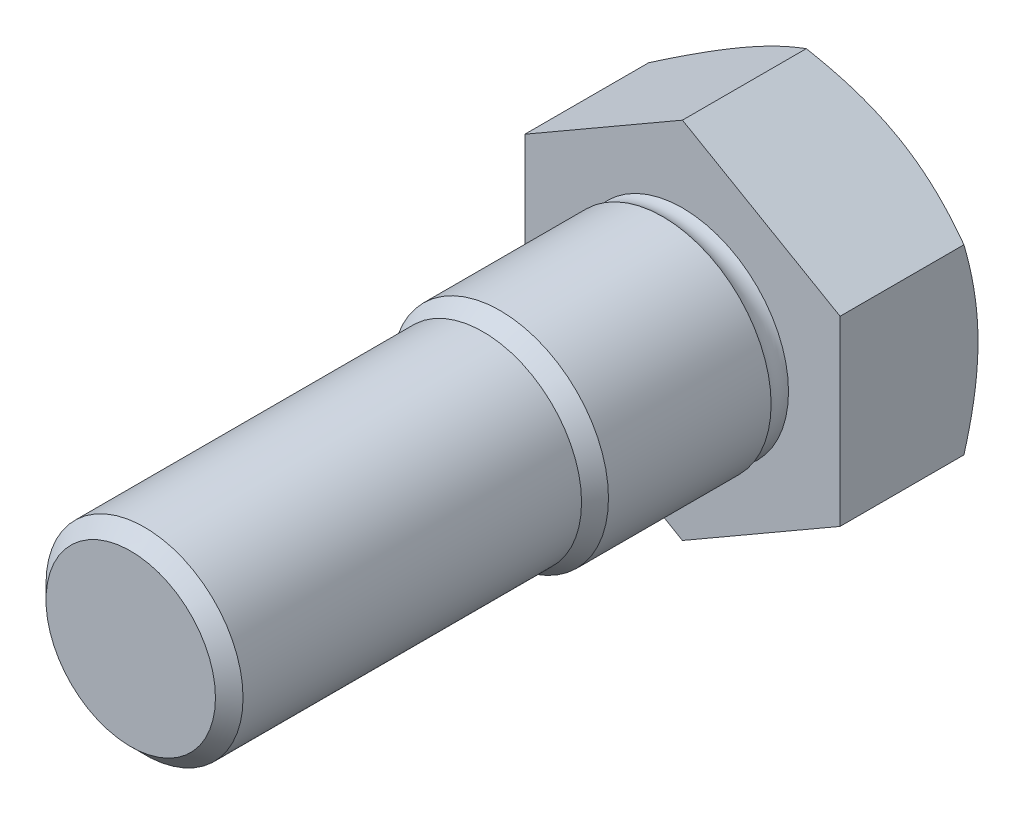
from build123d import *

# Parameters (mm, degrees)
VYSUNOUT1_DEPTH = 7
SKICA5_R        = 5
VYSUNOUT4_DEPTH = 28
ZKOSIT1_SIZE    = 0.7
SKICA3_R        = 5.3
VYSUNOUT2_DEPTH = 1
SKICA4_R        = 5.5
VYSUNOUT3_DEPTH = 9.12


with BuildPart() as part:
    # Skica1 → Vysunout1 (new body)
    with BuildSketch(Plane.XY):
        Polygon((8, -4.618802154), (8, 4.618802154), (0, 9.237604307), (-8, 4.618802154), (-8, -4.618802154), (0, -9.237604307), align=None)
    extrude(amount=VYSUNOUT1_DEPTH)

    # Skica2 → Odebrat otočením1 (revolve, cut)
    with BuildSketch(Plane(origin=(0, 0, 0), x_dir=(1, 0, 0), z_dir=(0, 1, 0))):
        Polygon((8, 0), (20.124355653, 0), (20.124355653, -7), align=None)
    revolve(axis=Axis((0, 0, 0), (0, 0, 1)), mode=Mode.SUBTRACT)

    # Skica5 → Vysunout4 (add)
    with BuildSketch(Plane.XY.offset(7)):
        Circle(SKICA5_R)
    extrude(amount=VYSUNOUT4_DEPTH)

    # Zkosit1
    zkosit1_edges = [part.edges().sort_by_distance(p)[0] for p in [
        (-5, 0, 35),
    ]]
    chamfer(zkosit1_edges, length=ZKOSIT1_SIZE)

    # Skica3 → Vysunout2 (add)
    with BuildSketch(Plane.XY.offset(7)):
        Circle(SKICA3_R)
    extrude(amount=VYSUNOUT2_DEPTH)

    # Skica4 → Vysunout3 (add)
    with BuildSketch(Plane.XY.offset(8)):
        Circle(SKICA4_R)
    extrude(amount=VYSUNOUT3_DEPTH)

    # Skica6 → Odebrat otočením2 (revolve, cut)
    with BuildSketch(Plane(origin=(0, 0, 0), x_dir=(1, 0, 0), z_dir=(0, 1, 0)), mode=Mode.PRIVATE) as odebrat_oto_en_m2_sk:
        Polygon((-5.5, -17.12), (-5.5, -16.253974596), (-5, -17.12), align=None)
    revolve(odebrat_oto_en_m2_sk.sketch.rotate(Axis((0, 0, 17.12), (0, 0, -1)), 180), axis=Axis((0, 0, 17.12), (0, 0, -1)), mode=Mode.SUBTRACT)

    # Skica7 → Otočit kolem osy1 (revolve)
    with BuildSketch(Plane(origin=(0, 0, 0), x_dir=(1, 0, 0), z_dir=(0, 1, 0))):
        with BuildLine():
            ThreePointArc((5.3, -7.4), (5.321093687, -7.195690356), (5.383484861, -7))
            Line((5.383484861, -7), (5.3, -7))
            Line((5.3, -7), (5.3, -7.4))
        make_face()
        with BuildLine():
            ThreePointArc((5.5, -8), (5.351316702, -7.716227766), (5.3, -7.4))
            Line((5.3, -7.4), (5.3, -8))
            Line((5.3, -8), (5.5, -8))
        make_face()
    revolve(axis=Axis((0, 0, 16.253974596), (0, 0, -1)))


solid = part.part
